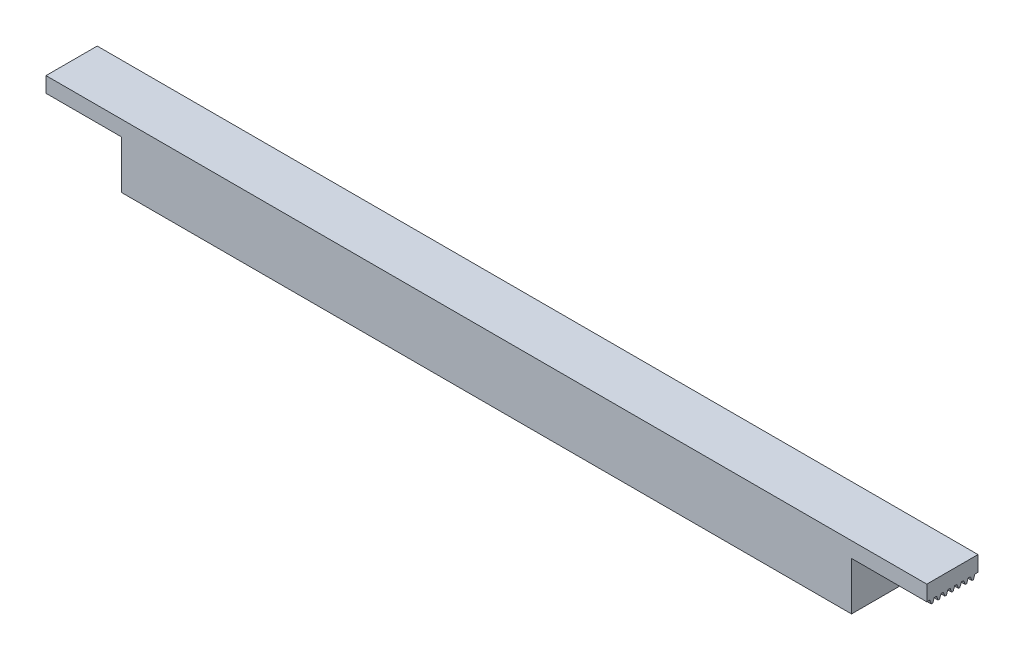
from build123d import *

# Parameters (mm, degrees)
SKETCH1_W                       = 86
SKETCH1_H                       = 5
BOSS_EXTRUDE1_DEPTH             = 6.2
SKETCH2_W                       = 7.35
SKETCH2_H                       = 4.7
CUT_EXTRUDE1_DEPTH              = 10
SKETCH3_R                       = 0.5
FIRST_HOLD_DOWN_CYLINDERS_DEPTH = 1
LPATTERN1_COUNT                 = 5
LPATTERN1_PITCH                 = 9
LPATTERN1_COL_COUNT             = 4
LPATTERN1_COL_PITCH             = 9
FIRST_RIDGE_DEPTH               = 7.35
RACK_LEFT_PATTERN_COUNT         = 4
RACK_LEFT_PATTERN_PITCH         = 0.66294
RACK_LEFT_PATTERN_COL_COUNT     = 4
RACK_LEFT_PATTERN_COL_PITCH     = 0.66
MIRROR2_COPY_1_DEPTH            = 7.35
MIRROR2_COPY_2_DEPTH            = 7.35
MIRROR2_COPY_3_DEPTH            = 7.35
MIRROR2_COPY_4_DEPTH            = 7.35
MIRROR2_COPY_5_DEPTH            = 7.35
MIRROR2_COPY_6_DEPTH            = 7.35


with BuildPart() as part:
    # Sketch1 → Boss-Extrude1 (new body)
    with BuildSketch(Plane(origin=(0, 0, 0), x_dir=(1, 0, 0), z_dir=(0, 1, 0))):
        Rectangle(SKETCH1_W, SKETCH1_H)
    extrude(amount=BOSS_EXTRUDE1_DEPTH)

    # Sketch2 → Cut-Extrude1 (cut)
    with BuildSketch(Plane.XY.offset(2.5)):
        with Locations((39.325, 2.35)):
            Rectangle(SKETCH2_W, SKETCH2_H)
    cut_extrude1 = extrude(amount=-CUT_EXTRUDE1_DEPTH, mode=Mode.SUBTRACT)

    # Mirror1: Cut-Extrude1 across plane
    add(cut_extrude1.mirror(Plane(origin=(0, 0, 0), x_dir=(0, 0, 1), z_dir=(1, 0, 0))), mode=Mode.SUBTRACT)

    # Sketch3 → First hold-down cylinders (add)
    with BuildSketch(Plane.XZ):
        with Locations(Location((-3, 0, 0), (0, 0, 90))):
            Circle(SKETCH3_R)
        with Locations(Location((-6, 0, 0), (0, 0, 90))):
            Circle(SKETCH3_R)
    first_hold_down_cylinders = extrude(amount=FIRST_HOLD_DOWN_CYLINDERS_DEPTH)

    # LPattern1: First hold-down cylinders ×5
    with Locations(*[(i * LPATTERN1_PITCH, 0, 0) for i in range(1, LPATTERN1_COUNT)]):
        add(first_hold_down_cylinders)

    # LPattern1 col: First hold-down cylinders ×4
    with Locations(*[(-i * LPATTERN1_COL_PITCH, 0, 0) for i in range(1, LPATTERN1_COL_COUNT)]):
        add(first_hold_down_cylinders)

    # Sketch4 → First Ridge (add)
    with BuildSketch(Plane(origin=(43, 0, 0), x_dir=(0, 0, -1), z_dir=(1, 0, 0))):
        Polygon((0.220588094, 4.7), (-0.220588094, 4.7), (-0.075, 4.3), (0.075, 4.3), align=None)
    first_ridge = extrude(amount=-FIRST_RIDGE_DEPTH)

    # Rack Left Pattern: First Ridge ×4
    with Locations(*[(0, 0, i * RACK_LEFT_PATTERN_PITCH) for i in range(1, RACK_LEFT_PATTERN_COUNT)]):
        add(first_ridge)

    # Rack Left Pattern col: First Ridge ×4
    with Locations(*[(0, 0, -i * RACK_LEFT_PATTERN_COL_PITCH) for i in range(1, RACK_LEFT_PATTERN_COL_COUNT)]):
        add(first_ridge)

    # Mirror2: First Ridge across plane
    add(first_ridge.mirror(Plane(origin=(0, 0, 0), x_dir=(0, 0, 1), z_dir=(1, 0, 0))))

    # Mirror2 copy 1 sketch → Mirror2 copy 1 (add)
    with BuildSketch(Plane(origin=(-43, 0, 0.66294), x_dir=(0, 0, -1), z_dir=(-1, 0, 0))):
        Polygon((0.220588094, -4.7), (-0.220588094, -4.7), (-0.075, -4.3), (0.075, -4.3), align=None)
    extrude(amount=-MIRROR2_COPY_1_DEPTH)

    # Mirror2 copy 2 sketch → Mirror2 copy 2 (add)
    with BuildSketch(Plane(origin=(-43, 0, 1.32588), x_dir=(0, 0, -1), z_dir=(-1, 0, 0))):
        Polygon((0.220588094, -4.7), (-0.220588094, -4.7), (-0.075, -4.3), (0.075, -4.3), align=None)
    extrude(amount=-MIRROR2_COPY_2_DEPTH)

    # Mirror2 copy 3 sketch → Mirror2 copy 3 (add)
    with BuildSketch(Plane(origin=(-43, 0, 1.98882), x_dir=(0, 0, -1), z_dir=(-1, 0, 0))):
        Polygon((0.220588094, -4.7), (-0.220588094, -4.7), (-0.075, -4.3), (0.075, -4.3), align=None)
    extrude(amount=-MIRROR2_COPY_3_DEPTH)

    # Mirror2 copy 4 sketch → Mirror2 copy 4 (add)
    with BuildSketch(Plane(origin=(-43, 0, -0.66), x_dir=(0, 0, -1), z_dir=(-1, 0, 0))):
        Polygon((0.220588094, -4.7), (-0.220588094, -4.7), (-0.075, -4.3), (0.075, -4.3), align=None)
    extrude(amount=-MIRROR2_COPY_4_DEPTH)

    # Mirror2 copy 5 sketch → Mirror2 copy 5 (add)
    with BuildSketch(Plane(origin=(-43, 0, -1.32), x_dir=(0, 0, -1), z_dir=(-1, 0, 0))):
        Polygon((0.220588094, -4.7), (-0.220588094, -4.7), (-0.075, -4.3), (0.075, -4.3), align=None)
    extrude(amount=-MIRROR2_COPY_5_DEPTH)

    # Mirror2 copy 6 sketch → Mirror2 copy 6 (add)
    with BuildSketch(Plane(origin=(-43, 0, -1.98), x_dir=(0, 0, -1), z_dir=(-1, 0, 0))):
        Polygon((0.220588094, -4.7), (-0.220588094, -4.7), (-0.075, -4.3), (0.075, -4.3), align=None)
    extrude(amount=-MIRROR2_COPY_6_DEPTH)


solid = part.part
